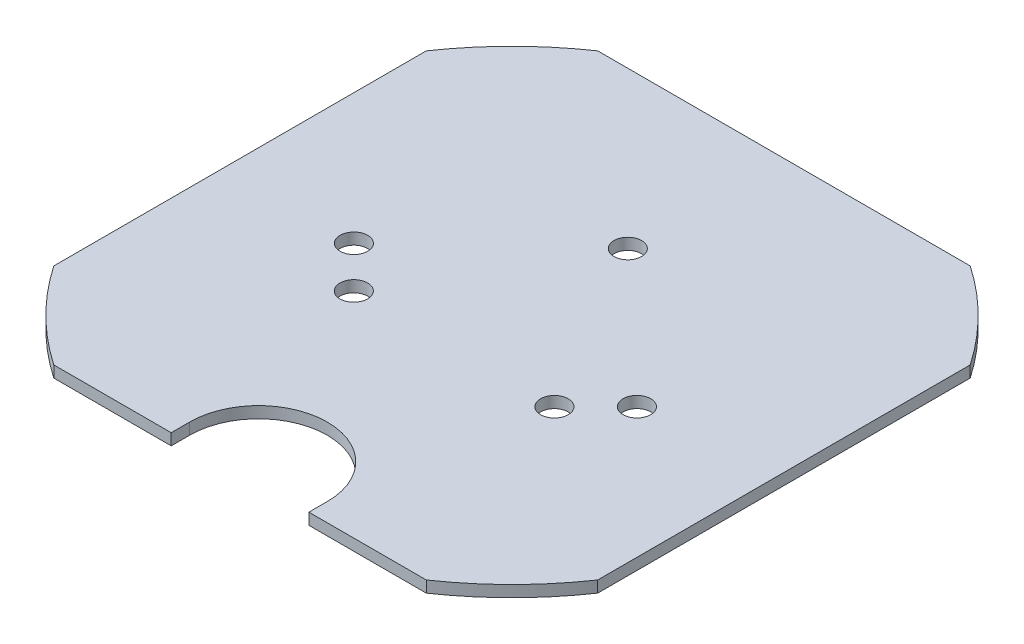
from build123d import *

# Parameters (mm, degrees)
SKETCH1_R           = 1.905
BOSS_EXTRUDE1_DEPTH = 1.5748


with BuildPart() as part:
    # Sketch1 → Boss-Extrude1 (new body)
    with BuildSketch(Plane(origin=(0, 0, 0), x_dir=(1, 0, 0), z_dir=(0, 1, 0))):
        with BuildLine():
            Line((-25.658087094, 37.465), (25.658087094, 37.465))
            ThreePointArc((25.658087094, 37.465), (32.108905761, 32.108905761), (37.465, 25.658087094))
            Line((37.465, 25.658087094), (37.465, -25.658087094))
            ThreePointArc((37.465, -25.658087094), (32.108905761, -32.108905761), (25.658087094, -37.465))
            Line((25.658087094, -37.465), (9.48055, -37.465))
            Line((9.48055, -37.465), (9.48055, -34.925))
            ThreePointArc((9.48055, -34.925), (0, -25.44445), (-9.48055, -34.925))
            Line((-9.48055, -34.925), (-9.48055, -37.465))
            Line((-9.48055, -37.465), (-25.658087094, -37.465))
            ThreePointArc((-25.658087094, -37.465), (-32.108905761, -32.108905761), (-37.465, -25.658087094))
            Line((-37.465, -25.658087094), (-37.465, 25.658087094))
            ThreePointArc((-37.465, 25.658087094), (-32.108905761, 32.108905761), (-25.658087094, 37.465))
        make_face()
        with Locations(Location((13.8176, -7.97759508, 0), (0, 0, 270))):
            Circle(SKETCH1_R, mode=Mode.SUBTRACT)
        with Locations(Location((0, 15.955190159, 0), (0, 0, 270))):
            Circle(SKETCH1_R, mode=Mode.SUBTRACT)
        with Locations(Location((-13.8176, -7.97759508, 0), (0, 0, 270))):
            Circle(SKETCH1_R, mode=Mode.SUBTRACT)
        with Locations(Location((-19.4945, -2.286, 0), (0, 0, 270))):
            Circle(SKETCH1_R, mode=Mode.SUBTRACT)
        with Locations(Location((19.4945, -2.286, 0), (0, 0, 270))):
            Circle(SKETCH1_R, mode=Mode.SUBTRACT)
    extrude(amount=BOSS_EXTRUDE1_DEPTH)


solid = part.part
